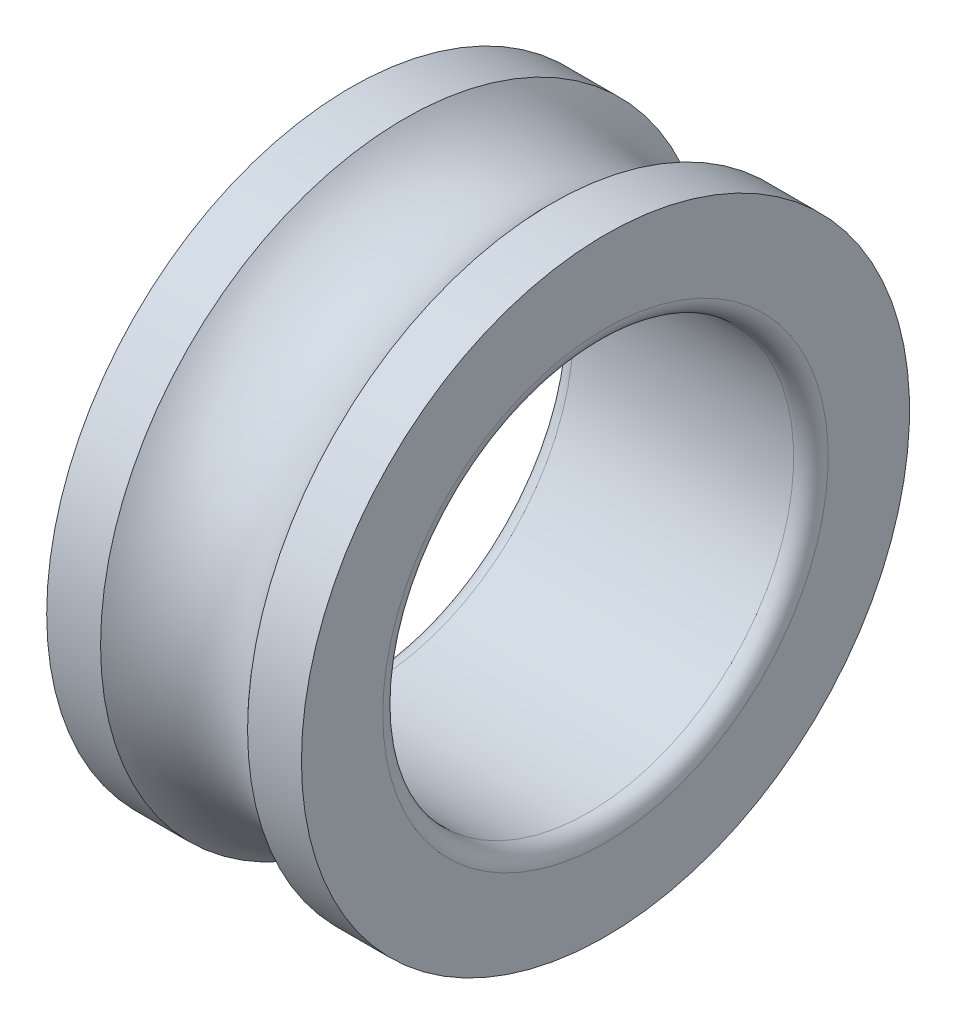
from build123d import *


with BuildPart() as part:
    # 草圖1 → 旋轉1 (revolve)
    with BuildSketch(Plane.XY, mode=Mode.PRIVATE) as revolve_1_sk:
        with BuildLine():
            Line((-13.4, 25), (13.4, 25))
            ThreePointArc((13.4, 25), (14.88492424, 25.61507576), (15.5, 27.1))
            Line((15.5, 27.1), (15.5, 37))
            Line((15.5, 37), (8.94427191, 37))
            ThreePointArc((8.94427191, 37), (0, 33), (-8.94427191, 37))
            Line((-8.94427191, 37), (-15.5, 37))
            Line((-15.5, 37), (-15.5, 27.1))
            ThreePointArc((-15.5, 27.1), (-14.88492424, 25.61507576), (-13.4, 25))
        make_face()
    revolve(revolve_1_sk.sketch.rotate(Axis((0, 0, 0), (1, 0, 0)), 90), axis=Axis((0, 0, 0), (1, 0, 0)))


solid = part.part
